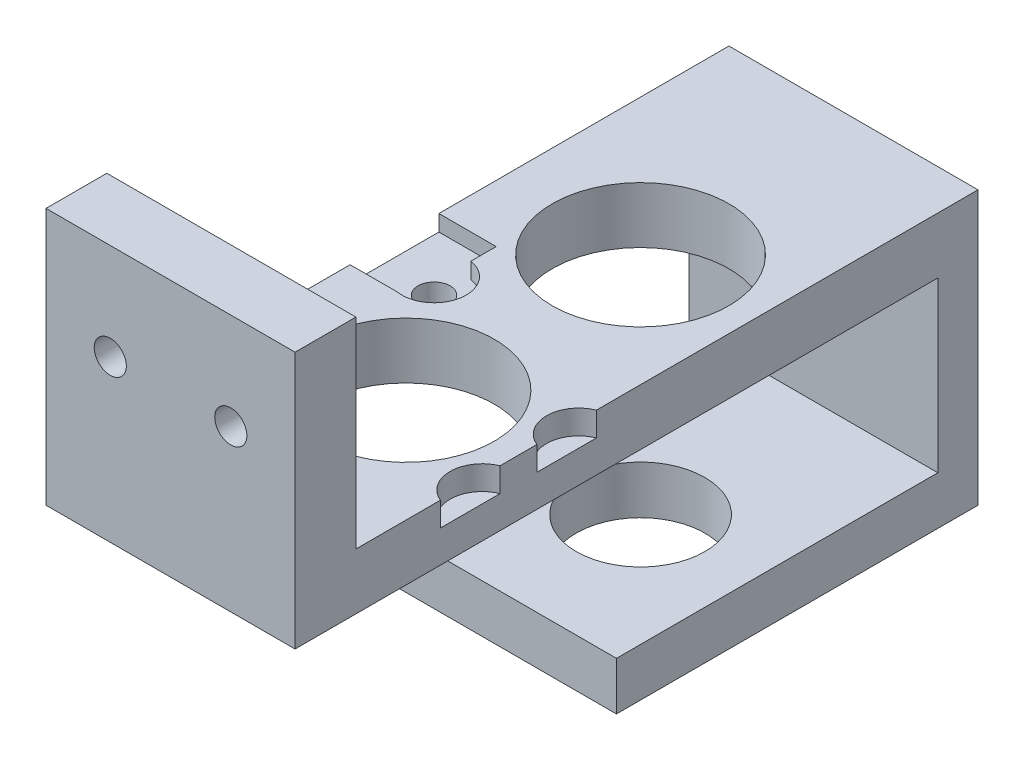
from build123d import *

# Parameters (mm, degrees)
SKETCH1_W           = 31
SKETCH1_H           = 85
BOSS_EXTRUDE1_DEPTH = 7
SKETCH2_R           = 11
CUT_EXTRUDE1_DEPTH  = 100
SKETCH3_R           = 11
CUT_EXTRUDE2_DEPTH  = 7
SKETCH4_W           = 31
SKETCH4_H           = 7.57
BOSS_EXTRUDE3_DEPTH = 25
SKETCH5_R           = 2
CUT_EXTRUDE3_DEPTH  = 14
SKETCH6_R           = 2
CUT_EXTRUDE4_DEPTH  = 14
SKETCH10_W          = 31
SKETCH10_H          = 5
BOSS_EXTRUDE4_DEPTH = 27
SKETCH11_W          = 31
SKETCH11_H          = 6
BOSS_EXTRUDE5_DEPTH = 40
SKETCH9_R           = 8
CUT_EXTRUDE5_DEPTH  = 40
SKETCH13_R          = 4
CUT_EXTRUDE6_DEPTH  = 2
SKETCH15_W          = 7.132198052
SKETCH15_H          = 11.047195358
SKETCH15_W_2        = 7.735251328
SKETCH15_H_2        = 9.356853031
CUT_EXTRUDE9_DEPTH  = 2
CUT_EXTRUDE10_DEPTH = 3


with BuildPart() as part:
    # Sketch1 → Boss-Extrude1 (new body)
    with BuildSketch(Plane(origin=(0, 0, 0), x_dir=(1, 0, 0), z_dir=(0, 1, 0))):
        with Locations((-34.66194332, -13.734817814)):
            Rectangle(SKETCH1_W, SKETCH1_H)
    extrude(amount=BOSS_EXTRUDE1_DEPTH)

    # Sketch2 → Cut-Extrude1 (cut)
    with BuildSketch(Plane(origin=(0, 7, 0), x_dir=(1, 0, 0), z_dir=(0, 1, 0))):
        with Locations(Location((-33.16194332, 0.765182186, 0), (0, 0, 270))):
            Circle(SKETCH2_R)
    extrude(amount=-CUT_EXTRUDE1_DEPTH, mode=Mode.SUBTRACT)

    # Sketch3 → Cut-Extrude2 (cut)
    with BuildSketch(Plane(origin=(0, 7, 0), x_dir=(1, 0, 0), z_dir=(0, 1, 0))):
        with Locations(Location((-33.16194332, -28.434817814, 0), (0, 0, 270))):
            Circle(SKETCH3_R)
    extrude(amount=-CUT_EXTRUDE2_DEPTH, mode=Mode.SUBTRACT)

    # Sketch4 → Boss-Extrude3 (add)
    with BuildSketch(Plane(origin=(0, 7, 0), x_dir=(1, 0, 0), z_dir=(0, 1, 0))):
        with Locations((-34.66194332, -52.449817814)):
            Rectangle(SKETCH4_W, SKETCH4_H)
    extrude(amount=BOSS_EXTRUDE3_DEPTH)

    # Sketch5 → Cut-Extrude3 (cut)
    with BuildSketch(Plane(origin=(0, 0, 48.664817814), x_dir=(-1, 0, 0), z_dir=(0, 0, -1))):
        with Locations((42.16194332, 20)):
            Circle(SKETCH5_R)
        with Locations((27.16194332, 20)):
            Circle(SKETCH5_R)
    extrude(amount=-CUT_EXTRUDE3_DEPTH, mode=Mode.SUBTRACT)

    # Sketch6 → Cut-Extrude4 (cut)
    with BuildSketch(Plane(origin=(0, 7, 0), x_dir=(1, 0, 0), z_dir=(0, 1, 0))):
        with Locations(Location((-43.66194332, -14.434817814, 0), (0, 0, 270))):
            Circle(SKETCH6_R)
        with Locations(Location((-43.66194332, -42.434817814, 0), (0, 0, 270))):
            Circle(SKETCH6_R)
    extrude(amount=-CUT_EXTRUDE4_DEPTH, mode=Mode.SUBTRACT)

    # Sketch10 → Boss-Extrude4 (add)
    with BuildSketch(Plane.XZ):
        with Locations((-34.66194332, -26.265182186)):
            Rectangle(SKETCH10_W, SKETCH10_H)
    extrude(amount=BOSS_EXTRUDE4_DEPTH)

    # Sketch11 → Boss-Extrude5 (add)
    with BuildSketch(Plane.XY.offset(-23.765182186)):
        with Locations((-34.66194332, -24)):
            Rectangle(SKETCH11_W, SKETCH11_H)
    extrude(amount=BOSS_EXTRUDE5_DEPTH)

    # Sketch9 → Cut-Extrude5 (cut)
    with BuildSketch(Plane(origin=(0, 7, 0), x_dir=(1, 0, 0), z_dir=(0, 1, 0))):
        with Locations(Location((-33.16194332, 0.765182186, 0), (0, 0, 270))):
            Circle(SKETCH9_R)
    extrude(amount=-CUT_EXTRUDE5_DEPTH, mode=Mode.SUBTRACT)

    # Sketch13 → Cut-Extrude6 (cut)
    with BuildSketch(Plane(origin=(0, 7, 0), x_dir=(1, 0, 0), z_dir=(0, 1, 0))):
        with Locations(Location((-43.66194332, -14.434817814, 0), (0, 0, 270))):
            Circle(SKETCH13_R)
        with Locations(Location((-43.66194332, -42.434817814, 0), (0, 0, 270))):
            Circle(SKETCH13_R)
    extrude(amount=-CUT_EXTRUDE6_DEPTH, mode=Mode.SUBTRACT)

    # Sketch15 → Cut-Extrude9 (cut)
    with BuildSketch(Plane(origin=(0, 7, 0), x_dir=(1, 0, 0), z_dir=(0, 1, 0))):
        with Locations((-46.595844294, -12.860944888)):
            Rectangle(SKETCH15_W, SKETCH15_H)
        with Locations((-46.294317656, -43.986391299)):
            Rectangle(SKETCH15_W_2, SKETCH15_H_2)
    extrude(amount=-CUT_EXTRUDE9_DEPTH, mode=Mode.SUBTRACT)

    # Sketch17 → Cut-Extrude10 (cut)
    with BuildSketch(Plane(origin=(0, 7, 0), x_dir=(1, 0, 0), z_dir=(0, 1, 0))):
        with BuildLine():
            ThreePointArc((-19.16194332, -18.72671857), (-21.66194332, -22.434817814), (-19.16194332, -26.142917057))
            Line((-19.16194332, -26.142917057), (-19.16194332, -18.72671857))
        make_face()
        with BuildLine():
            Line((-19.16194332, -38.142917057), (-19.16194332, -30.72671857))
            ThreePointArc((-19.16194332, -30.72671857), (-21.66194332, -34.434817814), (-19.16194332, -38.142917057))
        make_face()
    extrude(amount=-CUT_EXTRUDE10_DEPTH, mode=Mode.SUBTRACT)


solid = part.part
